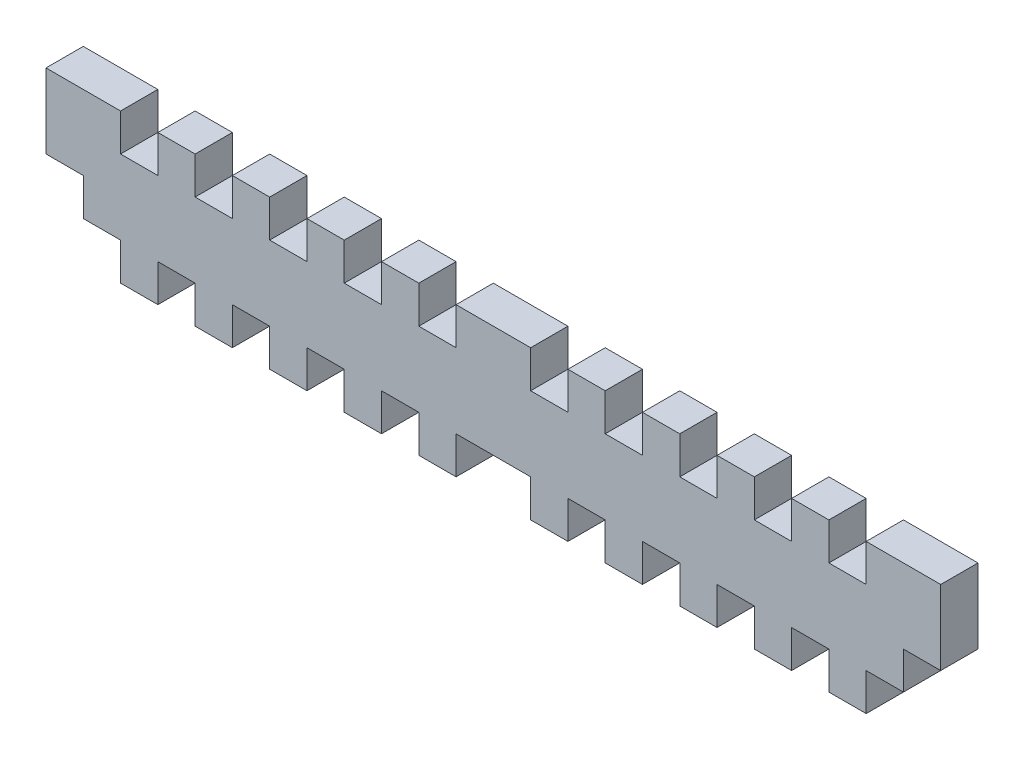
from build123d import *

# Parameters (mm, degrees)
BOSS_EXTRUDE1_DEPTH = 6.35


with BuildPart() as part:
    # Sketch1 → Boss-Extrude1 (new body)
    with BuildSketch(Plane.XY):
        Polygon((-76.2, 12.7), (-63.5, 12.7), (-63.5, 6.35), (-57.15, 6.35), (-57.15, 12.7), (-50.8, 12.7), (-50.8, 6.35), (-44.45, 6.35), (-44.45, 12.7), (-38.1, 12.7), (-38.1, 6.35), (-31.75, 6.35), (-31.75, 12.7), (-25.4, 12.7), (-25.4, 6.35), (-19.05, 6.35), (-19.05, 12.7), (-12.7, 12.7), (-12.7, 6.35), (-6.35, 6.35), (-6.35, 12.7), (6.35, 12.7), (6.35, 6.35), (12.7, 6.35), (12.7, 12.7), (19.05, 12.7), (19.05, 6.35), (25.4, 6.35), (25.4, 12.7), (31.75, 12.7), (31.75, 6.35), (38.1, 6.35), (38.1, 12.7), (44.45, 12.7), (44.45, 6.35), (50.8, 6.35), (50.8, 12.7), (57.15, 12.7), (57.15, 6.35), (63.5, 6.35), (63.5, 12.7), (76.2, 12.7), (76.2, 0), (69.85, 0), (69.85, -6.35), (63.5, -6.35), (63.5, -12.7), (57.15, -12.7), (57.15, -6.35), (50.8, -6.35), (50.8, -12.7), (44.45, -12.7), (44.45, -6.35), (38.1, -6.35), (38.1, -12.7), (31.75, -12.7), (31.75, -6.35), (25.4, -6.35), (25.4, -12.7), (19.05, -12.7), (19.05, -6.35), (12.7, -6.35), (12.7, -12.7), (6.35, -12.7), (6.35, -6.35), (-6.35, -6.35), (-6.35, -12.7), (-12.7, -12.7), (-12.7, -6.35), (-19.05, -6.35), (-19.05, -12.7), (-25.4, -12.7), (-25.4, -6.35), (-31.75, -6.35), (-31.75, -12.7), (-38.1, -12.7), (-38.1, -6.35), (-44.45, -6.35), (-44.45, -12.7), (-50.8, -12.7), (-50.8, -6.35), (-57.15, -6.35), (-57.15, -12.7), (-63.5, -12.7), (-63.5, -6.35), (-69.85, -6.35), (-69.85, 0), (-76.2, 0), align=None)
    extrude(amount=BOSS_EXTRUDE1_DEPTH)


solid = part.part
